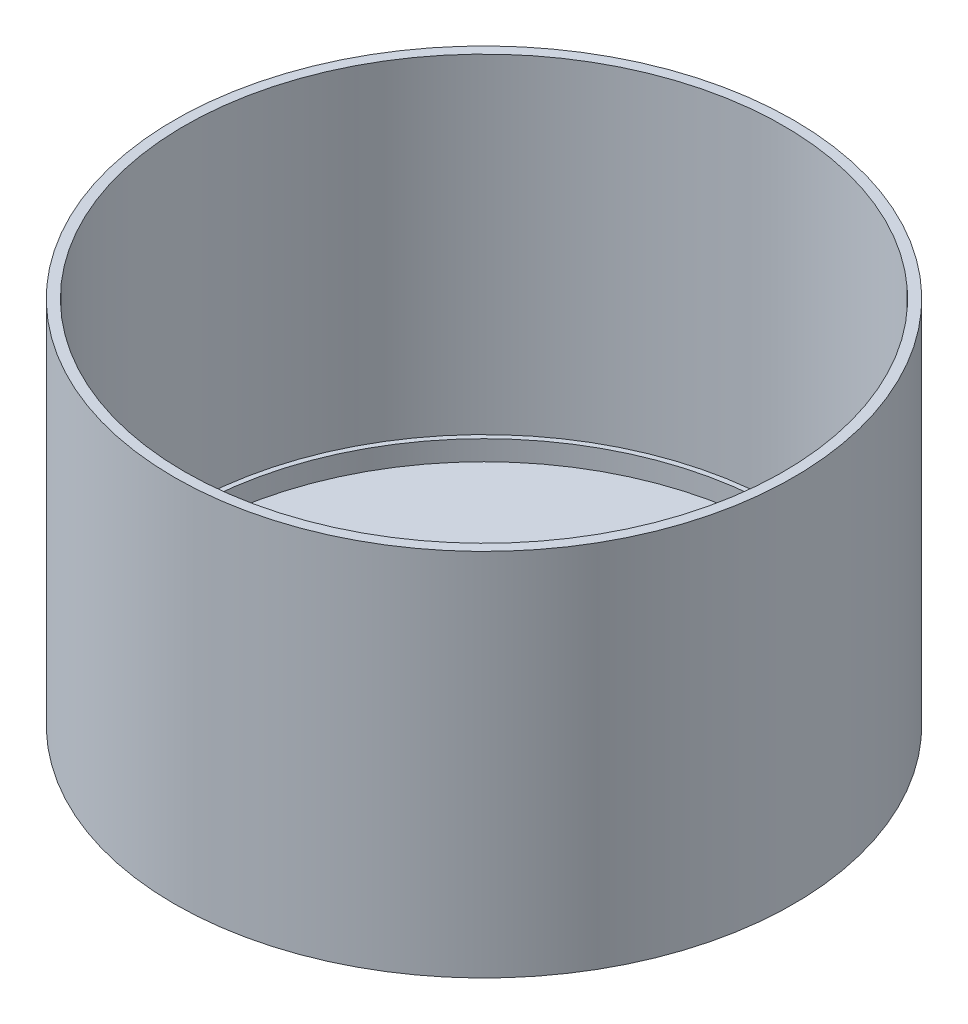
from build123d import *

# Parameters (mm, degrees)
SKETCH1_R           = 31
SKETCH1_R_2         = 30
BOSS_EXTRUDE1_DEPTH = 37
SKETCH2_R           = 31
BOSS_EXTRUDE2_DEPTH = 2
SKETCH5_R           = 30
SKETCH5_R_2         = 29.5
BOSS_EXTRUDE4_DEPTH = 2
SKETCH6_R           = 4
CUT_EXTRUDE1_DEPTH  = 2


with BuildPart() as part:
    # Sketch1 → Boss-Extrude1 (new body)
    with BuildSketch(Plane(origin=(0, 0, 0), x_dir=(1, 0, 0), z_dir=(0, 1, 0))):
        with Locations(Location((0, 0, 0), (0, 0, 270))):
            Circle(SKETCH1_R)
        with Locations(Location((0, 0, 0), (0, 0, 270))):
            Circle(SKETCH1_R_2, mode=Mode.SUBTRACT)
    extrude(amount=BOSS_EXTRUDE1_DEPTH)

    # Sketch2 → Boss-Extrude2 (add)
    with BuildSketch(Plane(origin=(0, 0, 0), x_dir=(1, 0, 0), z_dir=(0, 1, 0))):
        with Locations(Location((0, 0, 0), (0, 0, 270))):
            Circle(SKETCH2_R)
    extrude(amount=BOSS_EXTRUDE2_DEPTH)

    # Sketch5 → Boss-Extrude4 (add)
    with BuildSketch(Plane(origin=(0, 2, 0), x_dir=(1, 0, 0), z_dir=(0, 1, 0))):
        with Locations(Location((0, 0, 0), (0, 0, 270))):
            Circle(SKETCH5_R)
        with Locations(Location((0, 0, 0), (0, 0, 270))):
            Circle(SKETCH5_R_2, mode=Mode.SUBTRACT)
    extrude(amount=BOSS_EXTRUDE4_DEPTH)

    # Sketch6 → Cut-Extrude1 (cut)
    with BuildSketch(Plane(origin=(0, 2, 0), x_dir=(1, 0, 0), z_dir=(0, 1, 0))):
        with Locations(Location((0, 0, 0), (0, 0, 270))):
            Circle(SKETCH6_R)
    extrude(amount=-CUT_EXTRUDE1_DEPTH, mode=Mode.SUBTRACT)


solid = part.part
